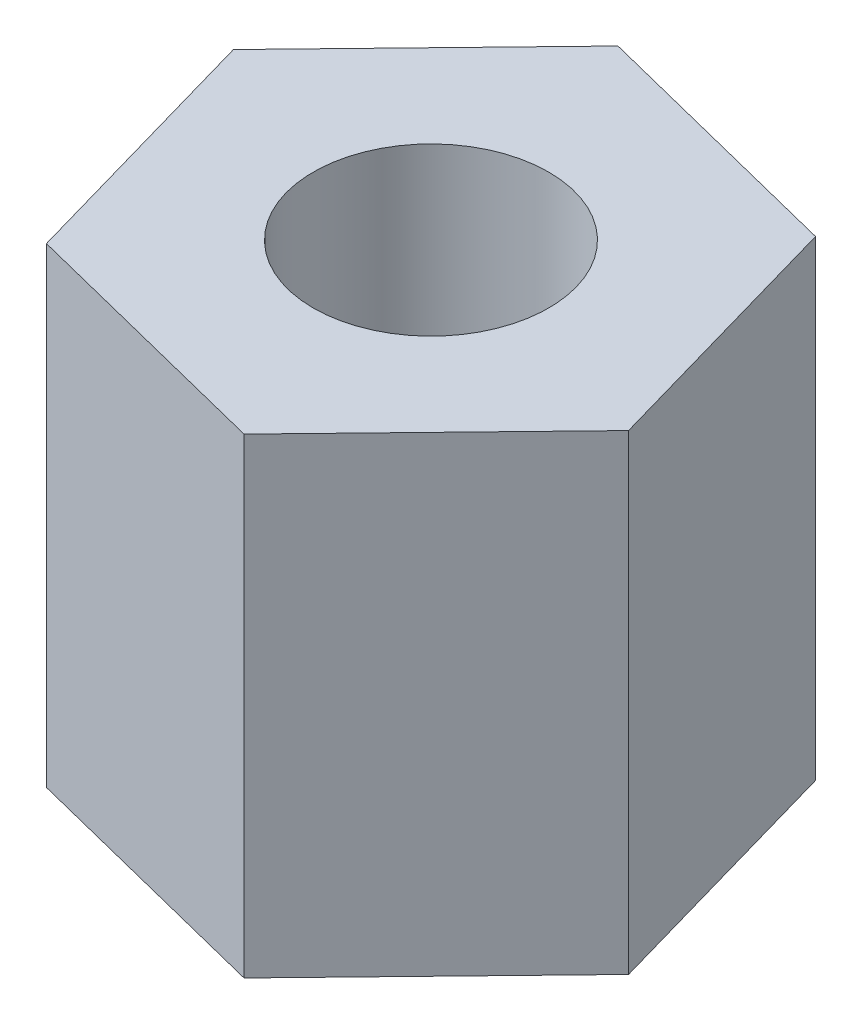
from build123d import *

# Parameters (mm, degrees)
CROQUIS1_R              = 2.5
SALIENTE_EXTRUIR1_DEPTH = 10


with BuildPart() as part:
    # Croquis1 → Saliente-Extruir1 (new body)
    with BuildSketch(Plane(origin=(0, 0, 0), x_dir=(1, 0, 0), z_dir=(0, 1, 0))):
        Polygon((-5.599940825, 1.404989713), (-4.016727196, -4.147196157), (1.583213629, -5.55218587), (5.599940825, -1.404989713), (4.016727196, 4.147196157), (-1.583213629, 5.55218587), align=None)
        with Locations(Location((0, 0, 0), (0, 0, 270))):
            Circle(CROQUIS1_R, mode=Mode.SUBTRACT)
    extrude(amount=SALIENTE_EXTRUIR1_DEPTH)


solid = part.part
